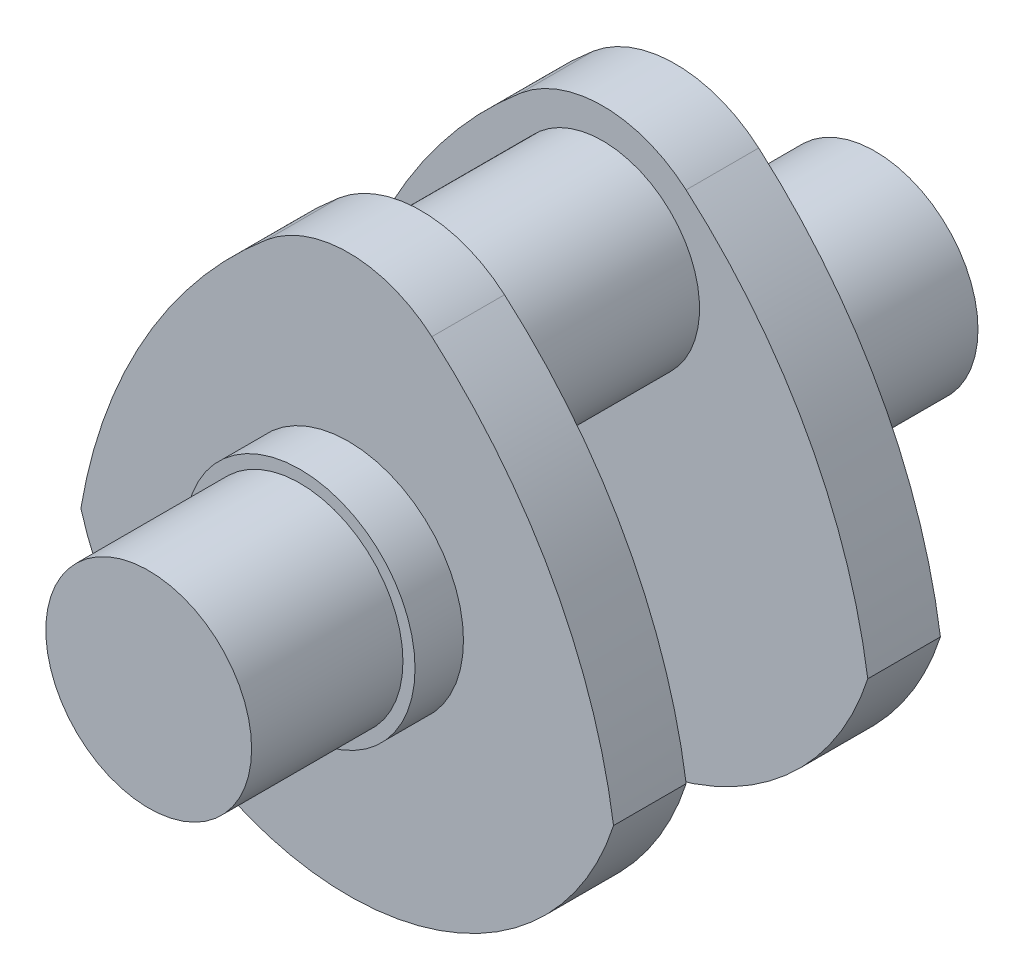
from build123d import *

# Parameters (mm, degrees)
SKETCH1_R           = 17
BOSS_EXTRUDE1_DEPTH = 25
SKETCH2_R           = 19
BOSS_EXTRUDE2_DEPTH = 8
BOSS_EXTRUDE3_DEPTH = 12
SKETCH4_R           = 16
BOSS_EXTRUDE4_DEPTH = 15


with BuildPart() as part:
    # Sketch1 → Boss-Extrude1 (new body)
    with BuildSketch(Plane.XY):
        Circle(SKETCH1_R)
    extrude(amount=BOSS_EXTRUDE1_DEPTH)

    # Sketch2 → Boss-Extrude2 (add)
    with BuildSketch(Plane(origin=(0, 0, 0), x_dir=(-1, 0, 0), z_dir=(0, 0, -1))):
        Circle(SKETCH2_R)
    extrude(amount=BOSS_EXTRUDE2_DEPTH)

    # Sketch3 → Boss-Extrude3 (add)
    with BuildSketch(Plane(origin=(0, 0, -8), x_dir=(-1, 0, 0), z_dir=(0, 0, -1))):
        with BuildLine():
            ThreePointArc((-43.790428919, -14.085394388), (-33.713723077, 16.075398615), (-13.776954685, 40.84914886))
            ThreePointArc((-13.776954685, 40.84914886), (-0.147298901, 45.999483399), (13.55326526, 41.040854117))
            ThreePointArc((13.55326526, 41.040854117), (33.645906333, 16.883464851), (44.209571081, -12.708808948))
            ThreePointArc((44.209571081, -12.708808948), (0.719490727, -45.994372842), (-43.790428919, -14.085394388))
        make_face()
    extrude(amount=BOSS_EXTRUDE3_DEPTH)

    # Sketch4 → Boss-Extrude4 (add)
    with BuildSketch(Plane(origin=(0, 0, -20), x_dir=(-1, 0, 0), z_dir=(0, 0, -1))):
        with Locations((0, 25)):
            Circle(SKETCH4_R)
    extrude(amount=BOSS_EXTRUDE4_DEPTH)

    # Mirror1: part across plane


with BuildPart() as part_1:
    add(part.part)
    add(part.part.mirror(Plane(origin=(0, 25, -35), x_dir=(1, 0, 0), z_dir=(0, 0, -1))))


solid = part_1.part
